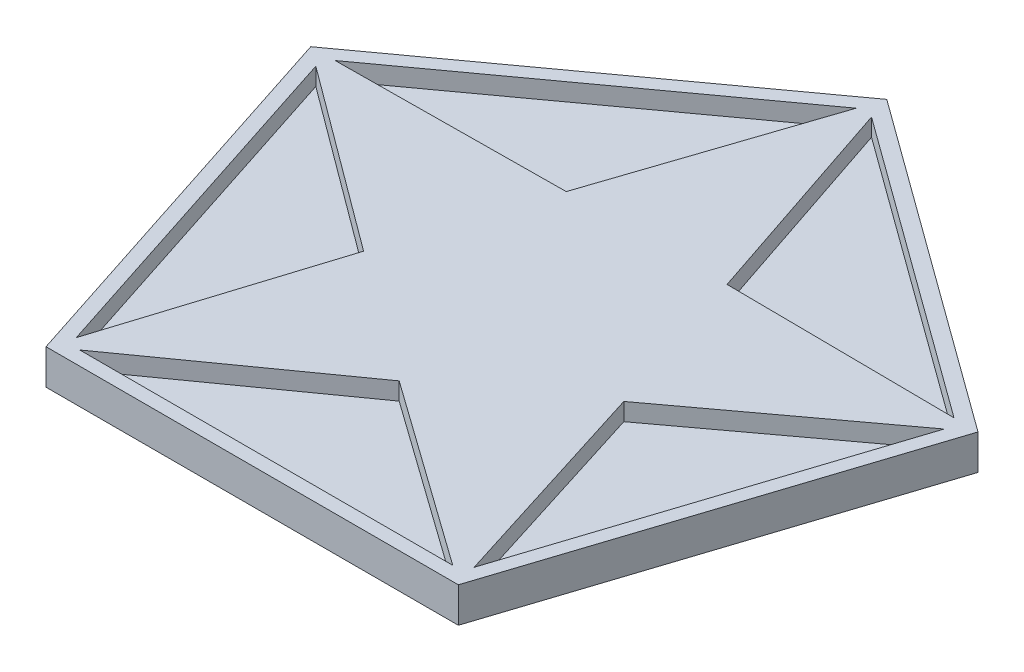
from build123d import *

# Parameters (mm, degrees)
BOSS_EXTRUDE1_DEPTH   = 1
BOSS_EXTRUDE2_DEPTH   = 0.5
BOSS_EXTRUDE2_2_DEPTH = 0.5
BOSS_EXTRUDE2_3_DEPTH = 0.5
BOSS_EXTRUDE2_4_DEPTH = 0.5
BOSS_EXTRUDE2_5_DEPTH = 0.5


with BuildPart() as part:
    # Sketch1 → Boss-Extrude1 (new body)
    with BuildSketch(Plane(origin=(0, 0, 0), x_dir=(1, 0, 0), z_dir=(0, 1, 0))):
        Polygon((9.510565163, 3.090169944), (0, 10), (-9.510565163, 3.090169944), (-5.877852523, -8.090169944), (5.877852523, -8.090169944), align=None)
        Polygon((5.6706701, -7.433384684), (8.956902373, 2.68059828), (3.709120414, -1.205166278), align=None, mode=Mode.SUBTRACT)
        Polygon((8.821902373, 3.096085557), (0.218434588, 9.346870791), (2.292362484, 3.155166278), align=None, mode=Mode.SUBTRACT)
        Polygon((-0.218434588, 9.346870791), (-8.821902373, 3.096085557), (-2.292362484, 3.155166278), align=None, mode=Mode.SUBTRACT)
        Polygon((-8.956902373, 2.68059828), (-5.6706701, -7.433384684), (-3.709120414, -1.205166278), align=None, mode=Mode.SUBTRACT)
        Polygon((-5.316743775, -7.690169944), (5.317235512, -7.690169944), (0, -3.9), align=None, mode=Mode.SUBTRACT)
    extrude(amount=BOSS_EXTRUDE1_DEPTH)


with BuildPart() as body_2:
    # Sketch3 → Boss-Extrude2 (new body)
    with BuildSketch(Plane.XZ):
        Polygon((8.956902373, -2.68059828), (3.709120414, 1.205166278), (5.6706701, 7.433384684), align=None)
    extrude(amount=-BOSS_EXTRUDE2_DEPTH)


with BuildPart() as body_3:
    # Sketch3 → Boss-Extrude2 2 (new body)
    with BuildSketch(Plane.XZ):
        Polygon((8.821902373, -3.096085557), (2.292362484, -3.155166278), (0.218434588, -9.346870791), align=None)
    extrude(amount=-BOSS_EXTRUDE2_2_DEPTH)


with BuildPart() as body_4:
    # Sketch3 → Boss-Extrude2 3 (new body)
    with BuildSketch(Plane.XZ):
        Polygon((-0.218434588, -9.346870791), (-2.292362484, -3.155166278), (-8.821902373, -3.096085557), align=None)
    extrude(amount=-BOSS_EXTRUDE2_3_DEPTH)


with BuildPart() as body_5:
    # Sketch3 → Boss-Extrude2 4 (new body)
    with BuildSketch(Plane.XZ):
        Polygon((-8.956902373, -2.68059828), (-3.709120414, 1.205166278), (-5.6706701, 7.433384684), align=None)
    extrude(amount=-BOSS_EXTRUDE2_4_DEPTH)


with BuildPart() as body_6:
    # Sketch3 → Boss-Extrude2 5 (new body)
    with BuildSketch(Plane.XZ):
        Polygon((0, 3.9), (5.317235512, 7.690169944), (-5.316743775, 7.690169944), align=None)
    extrude(amount=-BOSS_EXTRUDE2_5_DEPTH)


solid = Compound([part.part, body_2.part, body_3.part, body_4.part, body_5.part, body_6.part])
